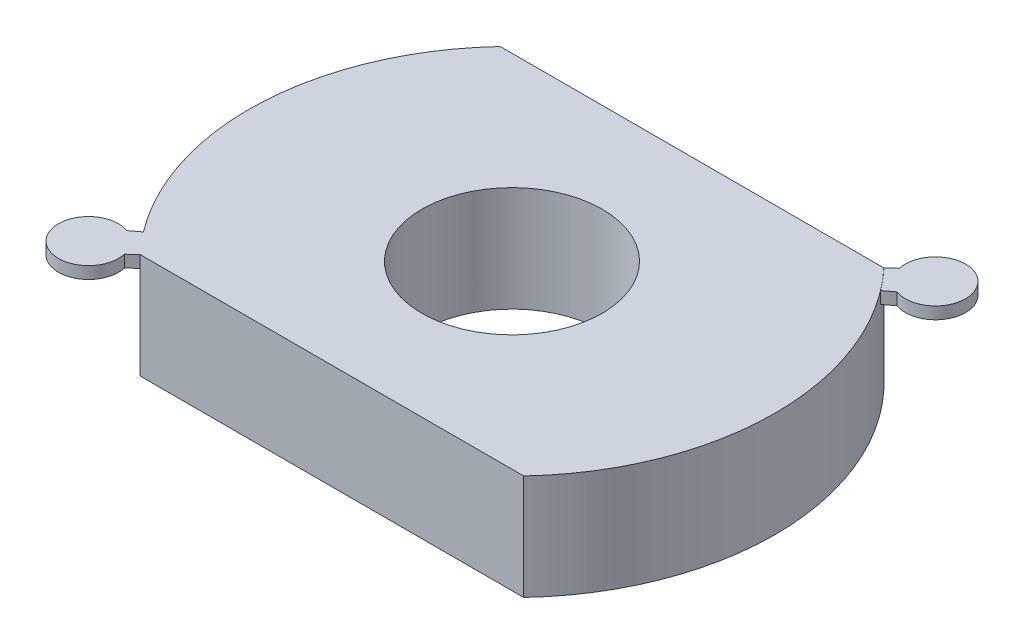
from build123d import *

# Parameters (mm, degrees)
SKETCH1_R                = 1750
BOSS_EXTRUDE1_DEPTH      = 700
CUT_EXTRUDE10_DEPTH      = 2572.964229922
CUT_EXTRUDE10_DEPTH_BACK = 2572.964229922
SKETCH9_W                = 5273.235769222
SKETCH9_H                = 4165.824449254
SKETCH9_W_2              = 4212.623718326
SKETCH9_H_2              = 2396.11984
CUT_EXTRUDE3_DEPTH       = 2234.348958831
CUT_EXTRUDE3_DEPTH_BACK  = 2234.348958831
SKETCH3_R                = 600
SHELL1_T                 = -1.5
BOSS_EXTRUDE2_START      = -80
BOSS_EXTRUDE2_DEPTH      = 80
BOSS_EXTRUDE3_DEPTH      = 80
BOSS_EXTRUDE4_DEPTH      = 50


with BuildPart() as part:
    # Sketch1 → Boss-Extrude1 (new body)
    with BuildSketch(Plane(origin=(0, 0, 0), x_dir=(1, 0, 0), z_dir=(0, 1, 0))):
        Circle(SKETCH1_R)
    extrude(amount=BOSS_EXTRUDE1_DEPTH)

    # Sketch9 → Cut-Extrude10 (cut, two sides: drawn at the far end of the back side and taken through both)
    with BuildSketch(Plane.XZ.offset(-CUT_EXTRUDE10_DEPTH_BACK)):
        Rectangle(SKETCH9_W, SKETCH9_H)
        Rectangle(SKETCH9_W_2, SKETCH9_H_2, mode=Mode.SUBTRACT)
    extrude(amount=CUT_EXTRUDE10_DEPTH + CUT_EXTRUDE10_DEPTH_BACK, mode=Mode.SUBTRACT)

    # Sketch3 → Cut-Extrude3 (cut, two sides: drawn at the far end of the back side and taken through both)
    with BuildSketch(Plane.XZ.offset(-CUT_EXTRUDE3_DEPTH_BACK)):
        Circle(SKETCH3_R)
    extrude(amount=CUT_EXTRUDE3_DEPTH + CUT_EXTRUDE3_DEPTH_BACK, mode=Mode.SUBTRACT)

    # Shell1
    shell1_openings = [part.faces().sort_by_distance(p)[0] for p in [
        (1707.583740986, 0, 0),
    ]]
    offset(amount=SHELL1_T, openings=shell1_openings, kind=Kind.INTERSECTION)

    # Sketch12 → Boss-Extrude2 (add)
    with BuildSketch(Plane(origin=(0, 700, 0), x_dir=(1, 0, 0), z_dir=(0, 1, 0)).offset(BOSS_EXTRUDE2_START)):
        with BuildLine():
            Line((-1329.427366657, -1248.362496346), (-1275.720428066, -1197.93046101))
            ThreePointArc((-1275.720428066, -1197.93046101), (-1337.090701529, -1129.021016582), (-1394.743394808, -1056.972498526))
            Line((-1394.743394808, -1056.972498526), (-1456.886660309, -1104.066267063))
            ThreePointArc((-1456.886660309, -1104.066267063), (-1674.443216413, -1424.679230146), (-1329.427366657, -1248.362496346))
        make_face()
    extrude(amount=BOSS_EXTRUDE2_DEPTH)

    # Sketch13 → Boss-Extrude4 (add)
    with BuildSketch(Plane(origin=(0, 698.5, 0), x_dir=(-1, 0, 0), z_dir=(0, -1, 0))):
        Polygon((838.224823525, -698.27995814), (994.506973536, -698.27995814), (1038.224823525, -698.27995814), (1038.224823525, -498.27995814), (838.224823525, -498.27995814), align=None)
        with BuildLine():
            ThreePointArc((965.724823525, -598.27995814), (961.964779353, -612.16032187), (951.712860088, -622.244992455))
            ThreePointArc((951.712860088, -622.244992455), (914.484867696, -584.399594411), (965.724823525, -598.27995814))
        make_face(mode=Mode.SUBTRACT)
    extrude(amount=BOSS_EXTRUDE4_DEPTH)


with BuildPart() as body_2:
    # Sketch12<6> → Boss-Extrude3 (new body)
    with BuildSketch(Plane(origin=(0, 700, 0), x_dir=(1, 0, 0), z_dir=(0, 1, 0))):
        with BuildLine():
            Line((1329.427366657, 1248.362496346), (1275.858293729, 1198.05992))
            ThreePointArc((1275.858293729, 1198.05992), (1337.197472539, 1129.114373304), (1394.743394808, 1056.972498526))
            Line((1394.743394808, 1056.972498526), (1456.886660309, 1104.066267063))
            ThreePointArc((1456.886660309, 1104.066267063), (1674.443216413, 1424.679230146), (1329.427366657, 1248.362496346))
        make_face()
    extrude(amount=-BOSS_EXTRUDE3_DEPTH)


solid = Compound([part.part, body_2.part])
